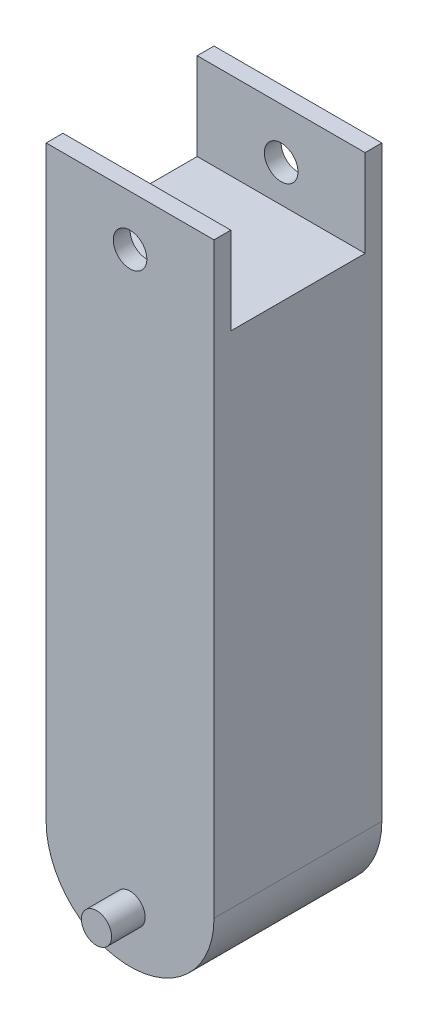
from build123d import *

# Parameters (mm, degrees)
SKETCH1_W               = 63.5
SKETCH1_H               = 254
BOSS_EXTRUDE1_DEPTH     = 63.5
FILLET1_RADIUS          = 31.75
FILLET1_LENGTH          = 63.5
SKETCH2_R               = 5.715
BOSS_EXTRUDE2_DEPTH     = 12.7
CUT_EXTRUDE1_DEPTH      = 84.836
CUT_EXTRUDE1_DEPTH_BACK = 60.96
SKETCH3_R               = 6.35
CUT_EXTRUDE2_DEPTH      = 69.596
CUT_EXTRUDE2_DEPTH_BACK = 117.602
SKETCH4_W               = 50.8
SKETCH4_H               = 54.314943323


with BuildPart() as part:
    # Sketch1 → Boss-Extrude1 (new body)
    with BuildSketch(Plane.XY):
        with Locations((31.75, 127)):
            Rectangle(SKETCH1_W, SKETCH1_H)
    extrude(amount=BOSS_EXTRUDE1_DEPTH)

    # Fillet1: full round fillet: the end face becomes a half cylinder, R = half its width
    fillet1_face = Plane((31.75, 0, 31.75), x_dir=(0, 0, 1), z_dir=(0, -1, 0))  # on the end face: x along it, z out of the body
    fillet1_slab = fillet1_face.offset(-FILLET1_RADIUS / 2) * Box(FILLET1_LENGTH, 2 * FILLET1_RADIUS, FILLET1_RADIUS, mode=Mode.PRIVATE)  # the body's end, R deep
    fillet1_round = Plane((31.75, 31.75, 31.75), x_dir=(0, -1, 0), z_dir=(0, 0, 1)) * Cylinder(FILLET1_RADIUS, FILLET1_LENGTH, mode=Mode.PRIVATE)  # its axis R under the face
    add(fillet1_slab - fillet1_round, mode=Mode.SUBTRACT)

    # Sketch2 → Boss-Extrude2 (add)
    with BuildSketch(Plane.XY.offset(63.5)):
        with Locations(Location((31.75, 19.05, 0), (0, 0, 180))):
            Circle(SKETCH2_R)
    boss_extrude2 = extrude(amount=BOSS_EXTRUDE2_DEPTH)

    # Mirror1: Boss-Extrude2 across plane
    add(boss_extrude2.mirror(Plane.XY.offset(31.75)))

    # Sketch3 → Cut-Extrude1 (cut, two sides: drawn at the far end of the back side and taken through both)
    with BuildSketch(Plane.XY.offset(31.75).offset(-CUT_EXTRUDE1_DEPTH_BACK)):
        with Locations(Location((31.75, 234.95, 0), (0, 0, 180))):
            Circle(SKETCH3_R)
    extrude(amount=CUT_EXTRUDE1_DEPTH + CUT_EXTRUDE1_DEPTH_BACK, mode=Mode.SUBTRACT)

    # Sketch4 → Cut-Extrude2 (cut, two sides: drawn at the far end of the back side and taken through both)
    with BuildSketch(Plane.ZY.offset(-CUT_EXTRUDE2_DEPTH_BACK)):
        with Locations((31.75, 248.137471662)):
            Rectangle(SKETCH4_W, SKETCH4_H)
    extrude(amount=CUT_EXTRUDE2_DEPTH + CUT_EXTRUDE2_DEPTH_BACK, mode=Mode.SUBTRACT)


solid = part.part
